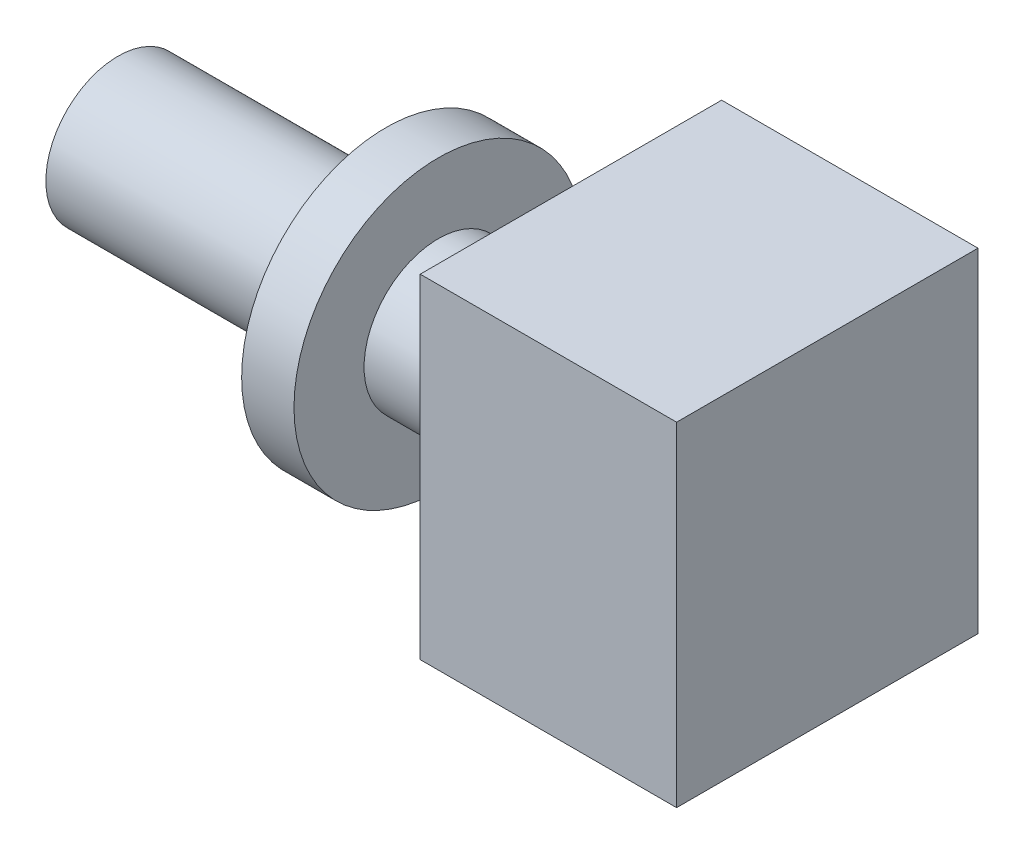
from build123d import *

# Parameters (mm, degrees)
SKETCH1_R           = 17.5
BOSS_EXTRUDE1_DEPTH = 65
SKETCH2_R           = 35
BOSS_EXTRUDE2_DEPTH = 12.7
SKETCH3_R           = 18
BOSS_EXTRUDE3_DEPTH = 31.6
SKETCH4_W           = 73.126959069
SKETCH4_H           = 81
BOSS_EXTRUDE4_DEPTH = 62.2


with BuildPart() as part:
    # Sketch1 → Boss-Extrude1 (new body)
    with BuildSketch(Plane(origin=(0, 0, 0), x_dir=(0, 0, -1), z_dir=(1, 0, 0))):
        Circle(SKETCH1_R)
    extrude(amount=-BOSS_EXTRUDE1_DEPTH)

    # Sketch2 → Boss-Extrude2 (add)
    with BuildSketch(Plane(origin=(0, 0, 0), x_dir=(0, 0, -1), z_dir=(1, 0, 0))):
        Circle(SKETCH2_R)
    extrude(amount=BOSS_EXTRUDE2_DEPTH)

    # Sketch3 → Boss-Extrude3 (add)
    with BuildSketch(Plane(origin=(12.7, 0, 0), x_dir=(0, 0, -1), z_dir=(1, 0, 0))):
        Circle(SKETCH3_R)
    extrude(amount=BOSS_EXTRUDE3_DEPTH)

    # Sketch4 → Boss-Extrude4 (add)
    with BuildSketch(Plane(origin=(44.3, 0, 0), x_dir=(0, 0, -1), z_dir=(1, 0, 0))):
        with Locations((0.590599522, 3.829138734)):
            Rectangle(SKETCH4_W, SKETCH4_H)
    extrude(amount=BOSS_EXTRUDE4_DEPTH)


solid = part.part
